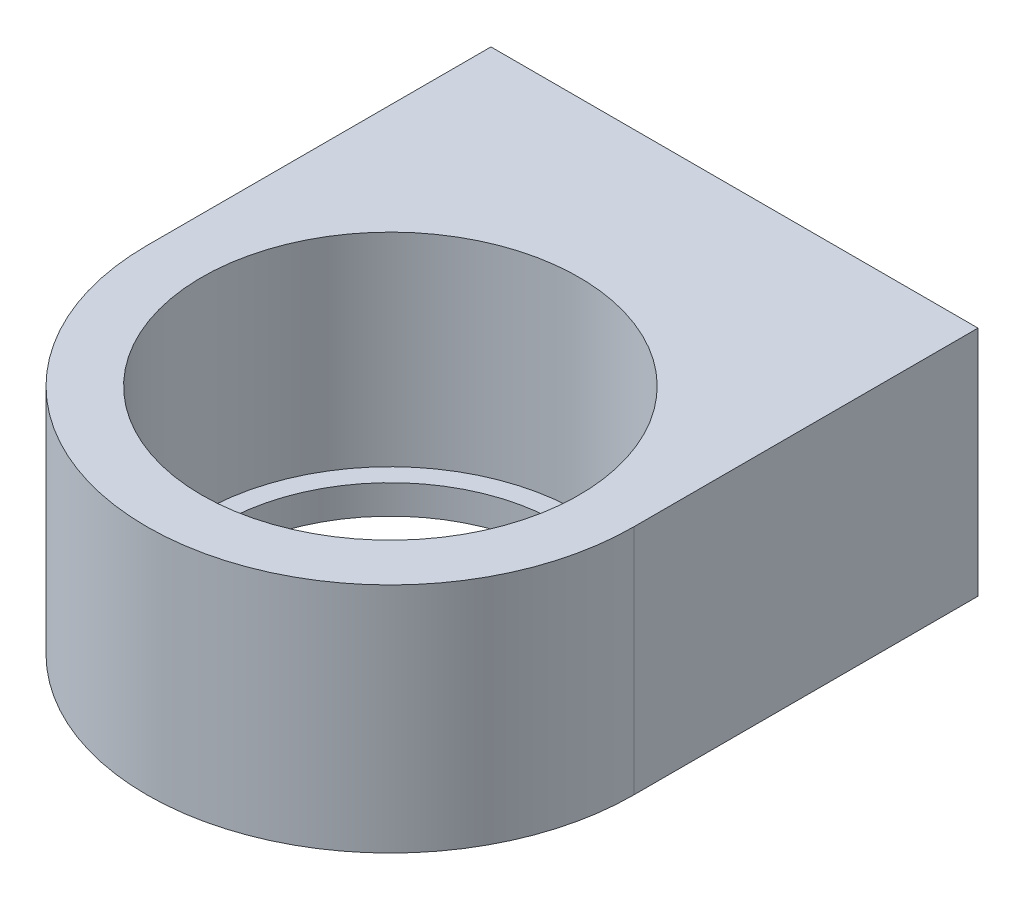
from build123d import *

# Parameters (mm, degrees)
SKETCH1_R           = 9.25
BOSS_EXTRUDE1_DEPTH = 12.7
SKETCH2_R           = 10.31875
CUT_EXTRUDE1_DEPTH  = 11.1125
SKETCH3_R           = 3
CUT_EXTRUDE2_DEPTH  = 7.5
BOSS_EXTRUDE2_START = 1
SKETCH4_W           = 26.6375
SKETCH4_H           = 12.7
SKETCH4_R           = 3
BOSS_EXTRUDE2_DEPTH = 1


with BuildPart() as part:
    # Sketch1 → Boss-Extrude1 (new body)
    with BuildSketch(Plane(origin=(0, 0, 0), x_dir=(1, 0, 0), z_dir=(0, 1, 0))):
        with BuildLine():
            Line((-13.31875, 0), (-13.31875, 13.31875))
            Line((-13.31875, 13.31875), (-13.31875, 17.81875))
            Line((-13.31875, 17.81875), (13.31875, 17.81875))
            Line((13.31875, 17.81875), (13.31875, 13.31875))
            Line((13.31875, 13.31875), (13.31875, 0))
            ThreePointArc((13.31875, 0), (0, -13.31875), (-13.31875, 0))
        make_face()
        with Locations(Location((0, 0, 0), (0, 0, 270))):
            Circle(SKETCH1_R, mode=Mode.SUBTRACT)
    extrude(amount=BOSS_EXTRUDE1_DEPTH)

    # Sketch2 → Cut-Extrude1 (cut)
    with BuildSketch(Plane(origin=(0, 12.7, 0), x_dir=(1, 0, 0), z_dir=(0, 1, 0))):
        with Locations(Location((0, 0, 0), (0, 0, 270))):
            Circle(SKETCH2_R)
    extrude(amount=-CUT_EXTRUDE1_DEPTH, mode=Mode.SUBTRACT)

    # Sketch3 → Cut-Extrude2 (cut)
    with BuildSketch(Plane(origin=(0, 0, -17.81875), x_dir=(-1, 0, 0), z_dir=(0, 0, -1))):
        with Locations((-7.81875, 6.35)):
            Circle(SKETCH3_R)
        with Locations((7.81875, 6.35)):
            Circle(SKETCH3_R)
    extrude(amount=-CUT_EXTRUDE2_DEPTH, mode=Mode.SUBTRACT)

    # Sketch4 → Boss-Extrude2 (add)
    with BuildSketch(Plane(origin=(0, 0, -17.81875), x_dir=(-1, 0, 0), z_dir=(0, 0, -1)).offset(BOSS_EXTRUDE2_START)):
        with Locations((0, 6.35)):
            Rectangle(SKETCH4_W, SKETCH4_H)
        with Locations((-7.81875, 6.35)):
            Circle(SKETCH4_R, mode=Mode.SUBTRACT)
        with Locations((7.81875, 6.35)):
            Circle(SKETCH4_R, mode=Mode.SUBTRACT)
    extrude(amount=-BOSS_EXTRUDE2_DEPTH)


solid = part.part
